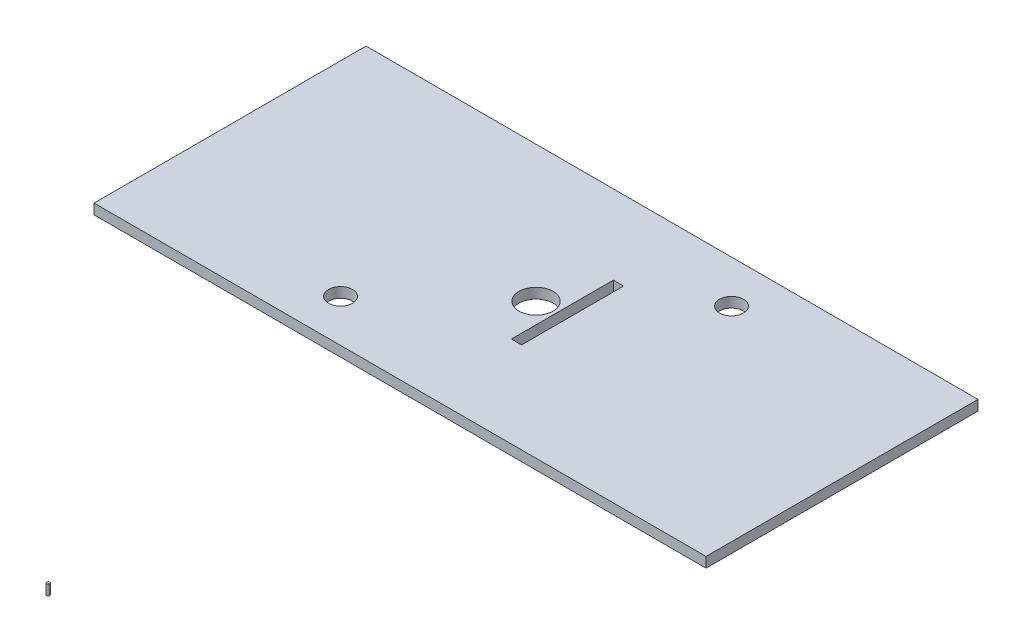
from build123d import *

# Parameters (mm, degrees)
ESBO_O1_R                  = 0.45
RESSALTO_EXTRUS_O1_DEPTH   = 3
ESBO_O1_W                  = 180
ESBO_O1_H                  = 80
ESBO_O1_R_2                = 5.025
RESSALTO_EXTRUS_O1_2_DEPTH = 3
ESBO_O3_R                  = 3.525
CORTE_EXTRUS_O2_DEPTH      = 100
ESBO_O4_W                  = 3
ESBO_O4_H                  = 30
CORTE_EXTRUS_O3_DEPTH      = 10


with BuildPart() as part:
    # Esboço1 → Ressalto-extrusão1 (new body)
    with BuildSketch(Plane(origin=(0, 0, 0), x_dir=(1, 0, 0), z_dir=(0, 1, 0))):
        with Locations(Location((0, -143.5, 0), (0, 0, 270))):
            Circle(ESBO_O1_R)
    extrude(amount=RESSALTO_EXTRUS_O1_DEPTH)


with BuildPart() as body_2:
    # Esboço1 → Ressalto-extrus_o1 2 (new body)
    with BuildSketch(Plane(origin=(0, 0, 0), x_dir=(1, 0, 0), z_dir=(0, 1, 0))):
        Rectangle(ESBO_O1_W, ESBO_O1_H)
        with Locations(Location((0, 0, 0), (0, 0, 270))):
            Circle(ESBO_O1_R_2, mode=Mode.SUBTRACT)
    extrude(amount=RESSALTO_EXTRUS_O1_2_DEPTH)

    # Esboço3 → Corte-extrusão2 (cut)
    with BuildSketch(Plane(origin=(0, 3, 0), x_dir=(1, 0, 0), z_dir=(0, 1, 0))):
        with Locations(Location((30, 27.5, 0), (0, 0, 270))):
            Circle(ESBO_O3_R)
        with Locations(Location((-30, -27.5, 0), (0, 0, 270))):
            Circle(ESBO_O3_R)
    extrude(amount=-CORTE_EXTRUS_O2_DEPTH, mode=Mode.SUBTRACT)

    # Esboço4 → Corte-extrusão3 (cut)
    with BuildSketch(Plane(origin=(0, 3, 0), x_dir=(1, 0, 0), z_dir=(0, 1, 0))):
        with Locations((7.5, 1.748092336)):
            Rectangle(ESBO_O4_W, ESBO_O4_H)
    extrude(amount=-CORTE_EXTRUS_O3_DEPTH, mode=Mode.SUBTRACT)


solid = Compound([part.part, body_2.part])
